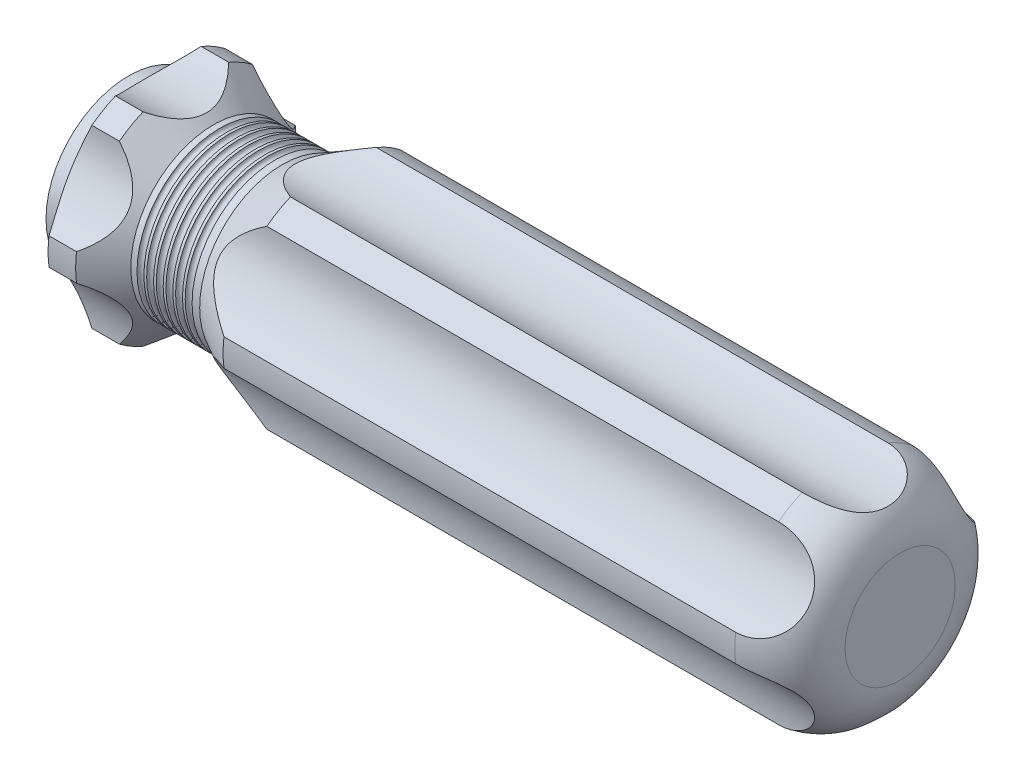
from build123d import *

# Parameters (mm, degrees)
SKETCH4_R          = 0.25
SKETCH5_R          = 6
CUT_EXTRUDE1_DEPTH = 58.131427554
CIRPATTERN1_COUNT  = 6
SKETCH6_W          = 0.189957265
SKETCH6_H          = 2.116666667
SKETCH6_H_2        = 2.170940171
CUT_EXTRUDE2_DEPTH = 1
SKETCH7_R          = 1.5
CUT_EXTRUDE3_DEPTH = 30


with BuildPart() as part:
    # Sketch1 → Revolve1 (revolve)
    with BuildSketch(Plane.XY, mode=Mode.PRIVATE) as revolve1_sk:
        with BuildLine():
            Line((0, 6), (1, 6))
            Line((1, 6), (2.154700538, 8))
            Line((2.154700538, 8), (4.154700538, 8))
            Line((4.154700538, 8), (6.154700538, 6))
            Line((6.154700538, 6), (11.154700538, 6))
            Line((11.154700538, 6), (14.855151909, 8))
            Line((14.855151909, 8), (52, 8))
            ThreePointArc((52, 8), (54.828427125, 6.828427125), (56, 4))
            Line((56, 4), (56, 0))
            Line((56, 0), (0, 0))
            Line((0, 0), (0, 6))
        make_face()
    revolve(revolve1_sk.sketch.rotate(Axis((0, 0, 0), (1, 0, 0)), 90), axis=Axis((0, 0, 0), (1, 0, 0)))

    # Sketch4 → Cut-Revolve2 (revolve, cut)
    with BuildSketch(Plane.XY, mode=Mode.PRIVATE) as cut_revolve2_sk:
        with Locations((6.854700538, 6)):
            Circle(SKETCH4_R)
        with Locations((7.554700538, 6)):
            Circle(SKETCH4_R)
        with Locations((8.254700538, 6)):
            Circle(SKETCH4_R)
        with Locations((8.954700538, 6)):
            Circle(SKETCH4_R)
        with Locations((9.654700538, 6)):
            Circle(SKETCH4_R)
        with Locations((10.354700538, 6)):
            Circle(SKETCH4_R)
    revolve(cut_revolve2_sk.sketch.rotate(Axis((0, 0, 0), (1, 0, 0)), 90), axis=Axis((0, 0, 0), (1, 0, 0)), mode=Mode.SUBTRACT)

    # Sketch5 → Cut-Extrude1 (cut, through all)
    with BuildSketch(Plane.ZY):
        with Locations((0, 12.5)):
            Circle(SKETCH5_R)
    cut_extrude1 = extrude(amount=-CUT_EXTRUDE1_DEPTH, mode=Mode.SUBTRACT)

    # CirPattern1: Cut-Extrude1 ×6 about axis
    cirpattern1_axis = Axis((0, 0, 0), (1, 0, 0))
    for i in range(1, CIRPATTERN1_COUNT):
        add(cut_extrude1.rotate(cirpattern1_axis, i * 360 / CIRPATTERN1_COUNT), mode=Mode.SUBTRACT)

    # Sketch6 → Cut-Extrude2 (cut)
    # profile 1 of 13: a face of its own
    with BuildSketch(Plane(origin=(0, 0, 0), x_dir=(1, 0, 0), z_dir=(0, 1, 0))):
        with Locations((20.973877339, 1.058333334)):
            Rectangle(SKETCH6_W, SKETCH6_H)
    # profile 2 of 13: a face of its own
    with BuildSketch(Plane(origin=(0, 0, 0), x_dir=(1, 0, 0), z_dir=(0, 1, 0))):
        with BuildLine():
            Line((21.378214946, 1.546794872), (21.568172211, 1.546794872))
            Line((21.568172211, 1.546794872), (21.568172211, 1.277971421))
            add(Edge.make_bspline(
                [(21.568172211, 1.277971421), (21.585277266, 1.301489161), (21.618052192, 1.346551406), (21.671794753, 1.405933149), (21.725483164, 1.456326843), (21.764147638, 1.482780865), (21.782722157, 1.49548945)],
                knots=[0, 0, 0, 0, 1.134379233, 2.173579362, 3.122582517, 4, 4, 4, 4], degree=3))
            add(Edge.make_bspline(
                [(21.782722157, 1.49548945), (21.80804031, 1.507587933), (21.858234278, 1.531573524), (21.937711619, 1.555905247), (22.019036776, 1.570858047), (22.073954125, 1.572902972), (22.101578995, 1.573931624)],
                knots=[0, 0, 0, 0, 1.014936303, 2.012140481, 3.000054389, 4, 4, 4, 4], degree=3))
            add(Edge.make_bspline(
                [(22.101578995, 1.573931624), (22.120261902, 1.573299472), (22.157234372, 1.572048477), (22.212016178, 1.56390836), (22.26514972, 1.549837865), (22.316321061, 1.53023915), (22.364533091, 1.506504249), (22.408734654, 1.47865514), (22.448421675, 1.447390718), (22.483574096, 1.411299173), (22.515184412, 1.36936704), (22.544260667, 1.320463423), (22.571127343, 1.263490218), (22.586017372, 1.222144739), (22.593856639, 1.20037727)],
                knots=[0, 0, 0, 0, 1.009824226, 1.998387844, 2.986035974, 3.974953746, 4.955485308, 5.885931332, 6.793869504, 7.679848016, 8.601185859, 9.625726857, 10.749998409, 12, 12, 12, 12], degree=3))
            add(Edge.make_bspline(
                [(22.593856639, 1.20037727), (22.602148682, 1.215329657), (22.618466257, 1.244753855), (22.64586538, 1.286396709), (22.674572095, 1.325347483), (22.70483105, 1.361637082), (22.736535443, 1.3950863), (22.769834481, 1.425805726), (22.80453861, 1.453927284), (22.852793917, 1.486779862), (22.915575828, 1.521675338), (22.994731973, 1.551930635), (23.07707041, 1.570627532), (23.132961114, 1.572822982), (23.161184363, 1.573931624)],
                knots=[0, 0, 0, 0, 0.86119277, 1.694706429, 2.50939023, 3.298075842, 4.073795165, 4.829715201, 5.57930267, 6.321991688, 7.768977793, 9.186738141, 10.579381044, 12, 12, 12, 12], degree=3))
            add(Edge.make_bspline(
                [(23.161184363, 1.573931624), (23.187117439, 1.57295359), (23.237870985, 1.571039484), (23.31175914, 1.55600905), (23.380666804, 1.530199235), (23.444455321, 1.49498175), (23.502004351, 1.450725767), (23.552028024, 1.398069851), (23.594222482, 1.337386456), (23.621786707, 1.280301777), (23.640483081, 1.229903742), (23.652010589, 1.186961842), (23.662194595, 1.13969876), (23.67064992, 1.088057983), (23.676829711, 1.031857091), (23.681408191, 0.971188057), (23.684507036, 0.906003727), (23.684726003, 0.861030306), (23.684838877, 0.837847222)],
                knots=[0, 0, 0, 0, 1.209669288, 2.367440248, 3.500751976, 4.631527125, 5.755587489, 6.87532382, 8.007944318, 9.190864318, 9.82315674, 10.514484317, 11.263564316, 12.079023757, 12.955305781, 13.901327259, 14.918167583, 16, 16, 16, 16], degree=3))
            Line((23.684838877, 0.837847222), (23.684838877, 0))
            Line((23.684838877, 0), (23.494881612, 0))
            Line((23.494881612, 0), (23.494881612, 0.838695246))
            add(Edge.make_bspline(
                [(23.494881612, 0.838695246), (23.494834512, 0.858483402), (23.494743991, 0.89651323), (23.493114986, 0.951094474), (23.490045629, 1.000847243), (23.486456586, 1.045703696), (23.481471044, 1.085768439), (23.47503279, 1.120960997), (23.468212479, 1.151558207), (23.456881665, 1.185476912), (23.438770321, 1.222893658), (23.411182607, 1.263245535), (23.376426876, 1.298370591), (23.336294781, 1.328861668), (23.29060596, 1.35365306), (23.240250627, 1.371358076), (23.185541415, 1.382318102), (23.147669538, 1.383410312), (23.128111447, 1.383974359)],
                knots=[0, 0, 0, 0, 1.253487763, 2.409012846, 3.458416907, 4.410876679, 5.259312806, 6.014470957, 6.676830364, 7.243083969, 8.276244668, 9.299465089, 10.325150304, 11.392391894, 12.482080715, 13.603491619, 14.762376348, 16, 16, 16, 16], degree=3))
            add(Edge.make_bspline(
                [(23.128111447, 1.383974359), (23.10412057, 1.383117921), (23.056705476, 1.381425274), (22.987493205, 1.364144884), (22.920986924, 1.338091589), (22.859171106, 1.300334818), (22.80230668, 1.255093569), (22.753381697, 1.201300242), (22.712964137, 1.140443096), (22.685596256, 1.084111519), (22.668306536, 1.033511427), (22.656890497, 0.989304921), (22.648010541, 0.939060353), (22.639682649, 0.883115347), (22.634247214, 0.821084809), (22.629307293, 0.753255681), (22.626996581, 0.679423953), (22.626673361, 0.628244956), (22.626505544, 0.601672676)],
                knots=[0, 0, 0, 0, 1.090531906, 2.155305635, 3.229839962, 4.33261226, 5.44038871, 6.529323825, 7.629011124, 8.757537029, 9.370236727, 10.061839251, 10.834451254, 11.692844982, 12.636905849, 13.66920014, 14.789842145, 16, 16, 16, 16], degree=3))
            Line((22.626505544, 0.601672676), (22.626505544, 0))
            Line((22.626505544, 0), (22.436548279, 0))
            Line((22.436548279, 0), (22.436548279, 0.7865418))
            add(Edge.make_bspline(
                [(22.436548279, 0.7865418), (22.436500242, 0.808732522), (22.436407824, 0.851425239), (22.434789289, 0.912647509), (22.431713094, 0.968334639), (22.428156763, 1.018421905), (22.423040369, 1.06281828), (22.417228751, 1.101761776), (22.410365544, 1.135154764), (22.399002137, 1.171781192), (22.381636721, 1.212131464), (22.353703819, 1.255154844), (22.318864949, 1.292812217), (22.278000658, 1.324960603), (22.232035317, 1.351534737), (22.181245355, 1.370681349), (22.126088098, 1.381823657), (22.088062057, 1.383243939), (22.068506078, 1.383974359)],
                knots=[0, 0, 0, 0, 1.320475261, 2.540461679, 3.643808994, 4.639130445, 5.527981419, 6.302341397, 6.981980563, 7.553956391, 8.582137848, 9.585246428, 10.591171744, 11.620968678, 12.668337649, 13.738356861, 14.836885341, 16, 16, 16, 16], degree=3))
            add(Edge.make_bspline(
                [(22.068506078, 1.383974359), (22.045515322, 1.383048795), (21.999695561, 1.381204179), (21.932384369, 1.36460088), (21.867381123, 1.338593654), (21.805722805, 1.302513668), (21.749072248, 1.257822321), (21.699476773, 1.205259503), (21.657782959, 1.145479373), (21.6301261, 1.089741784), (21.612286547, 1.040409375), (21.600436035, 0.998468564), (21.59025207, 0.951901747), (21.582684067, 0.900565256), (21.575378292, 0.844793452), (21.571852343, 0.784308498), (21.568422398, 0.719162283), (21.568257652, 0.674184601), (21.568172211, 0.65085804)],
                knots=[0, 0, 0, 0, 1.098833095, 2.189935336, 3.297829714, 4.440610912, 5.596351641, 6.740013378, 7.886572111, 9.072425424, 9.705826452, 10.395263256, 11.156850408, 11.985370555, 12.878090359, 13.847760091, 14.883794034, 16, 16, 16, 16], degree=3))
            Line((21.568172211, 0.65085804), (21.568172211, 0))
            Line((21.568172211, 0), (21.378214946, 0))
            Line((21.378214946, 0), (21.378214946, 1.546794872))
        make_face()
    # profile 3 of 13: a face of its own
    with BuildSketch(Plane(origin=(0, 0, 0), x_dir=(1, 0, 0), z_dir=(0, 1, 0))):
        with BuildLine():
            Line((23.885650843, 1.546794872), (24.075608108, 1.546794872))
            Line((24.075608108, 1.546794872), (24.075608108, 1.319100561))
            add(Edge.make_bspline(
                [(24.075608108, 1.319100561), (24.089631786, 1.34030099), (24.116451961, 1.380846647), (24.161030733, 1.434470462), (24.206692271, 1.478869086), (24.25365517, 1.514249785), (24.302264783, 1.540746291), (24.351454273, 1.560154936), (24.401997533, 1.571631693), (24.435962125, 1.573163953), (24.452978568, 1.573931624)],
                knots=[0, 0, 0, 0, 1.2804753, 2.448899062, 3.506932113, 4.484331642, 5.4025378, 6.288909075, 7.142734305, 8, 8, 8, 8], degree=3))
            add(Edge.make_bspline(
                [(24.452978568, 1.573931624), (24.466178298, 1.573211639), (24.493337602, 1.571730223), (24.534450883, 1.561321772), (24.576810494, 1.54470411), (24.60411089, 1.529076928), (24.618343151, 1.520930155)],
                knots=[0, 0, 0, 0, 0.901110191, 1.854092781, 2.881294221, 4, 4, 4, 4], degree=3))
            Line((24.618343151, 1.520930155), (24.51403626, 1.356413595))
            add(Edge.make_bspline(
                [(24.51403626, 1.356413595), (24.504898899, 1.360489851), (24.48755444, 1.368227366), (24.462181917, 1.377384677), (24.438788918, 1.382776683), (24.423885433, 1.383593545), (24.416937569, 1.383974359)],
                knots=[0, 0, 0, 0, 1.180555205, 2.24091978, 3.179933427, 4, 4, 4, 4], degree=3))
            add(Edge.make_bspline(
                [(24.416937569, 1.383974359), (24.401694101, 1.382958336), (24.370601846, 1.380885945), (24.324951697, 1.36459438), (24.280654577, 1.338271973), (24.245474572, 1.309079443), (24.218234733, 1.280929109), (24.198797549, 1.256346503), (24.180967507, 1.228782283), (24.163931231, 1.198707665), (24.148409234, 1.165609139), (24.133922362, 1.129817386), (24.120823907, 1.091290951), (24.11335495, 1.064450094), (24.109529048, 1.050701122)],
                knots=[0, 0, 0, 0, 1.125678352, 2.296057538, 3.5422874, 4.923748041, 5.663163013, 6.437101912, 7.23742474, 8.08941207, 8.991984279, 9.93940061, 10.944477711, 12, 12, 12, 12], degree=3))
            add(Edge.make_bspline(
                [(24.109529048, 1.050701122), (24.106667077, 1.03843826), (24.100328028, 1.011276952), (24.094164574, 0.965709035), (24.088074914, 0.911870917), (24.083783149, 0.84961274), (24.079805, 0.779089976), (24.077561283, 0.70019519), (24.075684622, 0.612847401), (24.075634387, 0.551781959), (24.075608108, 0.519838408)],
                knots=[0, 0, 0, 0, 0.566838948, 1.255505196, 2.06880316, 3.007127437, 4.065329342, 5.249902469, 6.561414163, 8, 8, 8, 8], degree=3))
            Line((24.075608108, 0.519838408), (24.075608108, 0))
            Line((24.075608108, 0), (23.885650843, 0))
            Line((23.885650843, 0), (23.885650843, 1.546794872))
        make_face()
    # profile 4 of 13: a face of its own
    with BuildSketch(Plane(origin=(0, 0, 0), x_dir=(1, 0, 0), z_dir=(0, 1, 0))):
        with BuildLine():
            Line((26.203129476, 1.546794872), (26.203129476, 0))
            Line((26.203129476, 0), (26.013172211, 0))
            Line((26.013172211, 0), (26.013172211, 0.267551416))
            add(Edge.make_bspline(
                [(26.013172211, 0.267551416), (25.991752275, 0.243336994), (25.949951002, 0.196082247), (25.880136612, 0.134346838), (25.806133, 0.083318044), (25.728299343, 0.042103571), (25.64670593, 0.011144565), (25.561533629, -0.010860398), (25.472747699, -0.025008098), (25.412118894, -0.026420835), (25.3813947, -0.027136752)],
                knots=[0, 0, 0, 0, 1.074387032, 2.096679803, 3.090159297, 4.057316773, 5.018401886, 5.985159533, 6.978961417, 8, 8, 8, 8], degree=3))
            add(Edge.make_bspline(
                [(25.3813947, -0.027136752), (25.354078842, -0.026395089), (25.300210761, -0.024932496), (25.220969367, -0.01358577), (25.144713578, 0.004636082), (25.071371336, 0.029976144), (25.001417229, 0.063589308), (24.934252314, 0.10383092), (24.870224543, 0.151752755), (24.81030985, 0.206536944), (24.755136212, 0.266042483), (24.706718204, 0.329509552), (24.666348484, 0.396663707), (24.632590626, 0.46665471), (24.606588075, 0.540021352), (24.588461163, 0.616509925), (24.577127655, 0.696029991), (24.575665666, 0.750180084), (24.574924347, 0.777637553)],
                knots=[0, 0, 0, 0, 1.033919861, 2.038935746, 3.024066025, 3.998881131, 4.97069526, 5.957263378, 6.95902576, 7.993208707, 9.027059324, 10.027763471, 11.009749337, 11.988697705, 12.965288445, 13.950418724, 14.960734635, 16, 16, 16, 16], degree=3))
            add(Edge.make_bspline(
                [(24.574924347, 0.777637553), (24.575682097, 0.804527507), (24.577180126, 0.857687496), (24.588339931, 0.935870328), (24.607106303, 1.011174228), (24.633442382, 1.083356761), (24.667213469, 1.152505267), (24.708293788, 1.218668654), (24.756686307, 1.282029194), (24.812477048, 1.341097031), (24.87291379, 1.395659022), (24.937568118, 1.443077825), (25.004831721, 1.484030396), (25.075747923, 1.516477974), (25.149267077, 1.542730147), (25.226043684, 1.560892942), (25.305758306, 1.571595608), (25.359878746, 1.57314547), (25.387330865, 1.573931624)],
                knots=[0, 0, 0, 0, 1.020392517, 2.01726096, 2.990465484, 3.961182959, 4.928053699, 5.906110375, 6.912531644, 7.948652711, 8.985773172, 9.998621852, 10.987621588, 11.969261332, 12.953316658, 13.946091881, 14.958173133, 16, 16, 16, 16], degree=3))
            add(Edge.make_bspline(
                [(25.387330865, 1.573931624), (25.418899351, 1.573062127), (25.480803662, 1.571357083), (25.571353458, 1.55716772), (25.657014643, 1.533195885), (25.738448465, 1.500588636), (25.815362499, 1.457258214), (25.887028589, 1.402599857), (25.954196763, 1.336958282), (25.993131511, 1.286539013), (26.013172211, 1.260586939)],
                knots=[0, 0, 0, 0, 1.038897134, 2.037228247, 3.008116434, 3.962042015, 4.918381754, 5.904844433, 6.921570401, 8, 8, 8, 8], degree=3))
            Line((26.013172211, 1.260586939), (26.013172211, 1.546794872))
            Line((26.013172211, 1.546794872), (26.203129476, 1.546794872))
        make_face()
        with BuildLine():
            add(Edge.make_bspline(
                [(25.389874935, 1.383974359), (25.362107693, 1.382986397), (25.307299573, 1.381036318), (25.226839629, 1.365812347), (25.149845326, 1.34048214), (25.076701747, 1.305840228), (25.008564302, 1.262279992), (24.947668606, 1.209592298), (24.893516591, 1.149214675), (24.847973022, 1.08141959), (24.810846388, 1.008740458), (24.784740612, 0.932767584), (24.767523495, 0.85487124), (24.765764533, 0.802037616), (24.764881612, 0.775517495)],
                knots=[0, 0, 0, 0, 1.031046209, 2.035121221, 3.029706178, 4.034933723, 5.034054252, 6.02443088, 7.017295772, 8.038157696, 9.050218397, 10.03989886, 11.016116709, 12, 12, 12, 12], degree=3))
            add(Edge.make_bspline(
                [(24.764881612, 0.775517495), (24.766009429, 0.749155858), (24.768260641, 0.696535915), (24.784438442, 0.618533375), (24.81158008, 0.542542598), (24.848616946, 0.469208568), (24.894994095, 0.401121993), (24.948750566, 0.339593443), (25.010406213, 0.286683073), (25.078700467, 0.242391778), (25.151639573, 0.206612539), (25.228343903, 0.181717129), (25.307371551, 0.1656439), (25.361106057, 0.16376643), (25.388178888, 0.162820513)],
                knots=[0, 0, 0, 0, 0.979072187, 1.954306742, 2.945804271, 3.96968567, 4.997920485, 5.998718438, 6.996577872, 8.005894225, 9.015743152, 10.005417472, 10.995077863, 12, 12, 12, 12], degree=3))
            add(Edge.make_bspline(
                [(25.388178888, 0.162820513), (25.415663202, 0.163824396), (25.470326775, 0.165821019), (25.551025422, 0.181110166), (25.629339043, 0.206370344), (25.704200843, 0.24138553), (25.773939646, 0.284781645), (25.83653122, 0.335585933), (25.889457543, 0.394673097), (25.934326407, 0.459610285), (25.969508683, 0.530798017), (25.995136109, 0.60659536), (26.010287757, 0.687004956), (26.012197432, 0.741955997), (26.013172211, 0.770005342)],
                knots=[0, 0, 0, 0, 1.01762866, 2.023962475, 3.030623092, 4.058876274, 5.077231937, 6.066672613, 7.034107872, 8.005628644, 8.981990164, 9.965428785, 10.961468474, 12, 12, 12, 12], degree=3))
            add(Edge.make_bspline(
                [(26.013172211, 0.770005342), (26.012591847, 0.791376316), (26.011449508, 0.833441155), (26.002722449, 0.895203987), (25.988840184, 0.954309621), (25.969278453, 1.0108202), (25.943581343, 1.064423281), (25.912588646, 1.115503745), (25.87575535, 1.163795925), (25.833674386, 1.20863483), (25.787612573, 1.249532738), (25.738872066, 1.286038731), (25.686875395, 1.316028132), (25.632496996, 1.34084833), (25.575642523, 1.360599339), (25.515849338, 1.373775706), (25.453752998, 1.382823139), (25.411391813, 1.383586579), (25.389874935, 1.383974359)],
                knots=[0, 0, 0, 0, 1.050140795, 2.067009409, 3.05949893, 4.030605086, 5.00011959, 5.97591094, 6.962425594, 7.979863591, 8.993523472, 9.986985069, 10.967611495, 11.937549037, 12.921786183, 13.919465291, 14.943216303, 16, 16, 16, 16], degree=3))
        make_face(mode=Mode.SUBTRACT)
    # profile 5 of 13: a face of its own
    with BuildSketch(Plane(origin=(0, 0, 0), x_dir=(1, 0, 0), z_dir=(0, 1, 0))):
        with BuildLine():
            Line((26.458214946, 1.546794872), (26.648172211, 1.546794872))
            Line((26.648172211, 1.546794872), (26.648172211, 1.267795139))
            add(Edge.make_bspline(
                [(26.648172211, 1.267795139), (26.668454495, 1.293100024), (26.707812975, 1.342205035), (26.773359691, 1.406745573), (26.842631478, 1.459931495), (26.915204118, 1.502327599), (26.991176129, 1.534287225), (27.070084416, 1.557368527), (27.152401405, 1.571208399), (27.20838085, 1.573016776), (27.236700523, 1.573931624)],
                knots=[0, 0, 0, 0, 1.12780773, 2.188550248, 3.19190651, 4.159438251, 5.104880172, 6.052711206, 7.014878035, 8, 8, 8, 8], degree=3))
            add(Edge.make_bspline(
                [(27.236700523, 1.573931624), (27.265324287, 1.572876196), (27.321347899, 1.57081047), (27.402917012, 1.554471804), (27.479100921, 1.526564912), (27.549627986, 1.48833666), (27.61320492, 1.440798459), (27.669039473, 1.385415705), (27.715221056, 1.321712455), (27.746183271, 1.262613213), (27.766579258, 1.210187132), (27.779419766, 1.165285526), (27.790324217, 1.11526074), (27.799777703, 1.060263941), (27.806174337, 0.999909797), (27.811219437, 0.934445717), (27.814835124, 0.863892904), (27.814978578, 0.815096706), (27.815052553, 0.789933894)],
                knots=[0, 0, 0, 0, 1.235846778, 2.418850247, 3.575807741, 4.728682307, 5.871620074, 6.994088408, 8.11269785, 9.256955736, 9.865816715, 10.540099792, 11.271859618, 12.076849838, 12.949306005, 13.892391288, 14.913166135, 16, 16, 16, 16], degree=3))
            Line((27.815052553, 0.789933894), (27.815052553, 0))
            Line((27.815052553, 0), (27.625095288, 0))
            Line((27.625095288, 0), (27.625095288, 0.727604167))
            add(Edge.make_bspline(
                [(27.625095288, 0.727604167), (27.624978443, 0.748663455), (27.624754938, 0.788946289), (27.62405, 0.846621841), (27.622350736, 0.898925629), (27.619962946, 0.945732608), (27.616468009, 0.986997833), (27.612825751, 1.022805348), (27.608371694, 1.053109691), (27.604402694, 1.071352383), (27.602622665, 1.079533921)],
                knots=[0, 0, 0, 0, 1.430800155, 2.736877192, 3.918605307, 4.986035426, 5.920637409, 6.731861385, 7.431261377, 8, 8, 8, 8], degree=3))
            add(Edge.make_bspline(
                [(27.602622665, 1.079533921), (27.596196748, 1.103549733), (27.583828847, 1.14977274), (27.553267819, 1.212471039), (27.514675433, 1.265809943), (27.467565781, 1.309459675), (27.412393912, 1.343429657), (27.349312926, 1.36699962), (27.278931557, 1.381741459), (27.229429145, 1.383209296), (27.203627606, 1.383974359)],
                knots=[0, 0, 0, 0, 1.084156227, 2.086665306, 3.027808233, 3.945421172, 4.874247719, 5.839848303, 6.874090471, 8, 8, 8, 8], degree=3))
            add(Edge.make_bspline(
                [(27.203627606, 1.383974359), (27.188346674, 1.383686489), (27.158106103, 1.383116803), (27.113263025, 1.377401018), (27.069766025, 1.368052333), (27.027178565, 1.355431776), (26.986352423, 1.338097928), (26.945975923, 1.318425404), (26.907569452, 1.29390339), (26.870314064, 1.266573824), (26.835653461, 1.236287827), (26.803402514, 1.20432948), (26.77465333, 1.170296139), (26.748607036, 1.134736171), (26.726123038, 1.097161202), (26.706496647, 1.05793374), (26.689844108, 1.017002155), (26.681569337, 0.988593428), (26.677429022, 0.974379006)],
                knots=[0, 0, 0, 0, 1.023777757, 2.026029729, 3.023749952, 4.003683103, 4.997618607, 5.993177895, 7.010360494, 8.046726602, 9.087585522, 10.09234134, 11.086953743, 12.070360549, 13.043493632, 14.017870808, 15.008233677, 16, 16, 16, 16], degree=3))
            add(Edge.make_bspline(
                [(26.677429022, 0.974379006), (26.675046472, 0.963943717), (26.669859787, 0.941226638), (26.664257769, 0.903946441), (26.659173187, 0.860820885), (26.654917503, 0.811900293), (26.652313751, 0.757013388), (26.649474759, 0.696394572), (26.648441184, 0.629802129), (26.648264379, 0.583440057), (26.648172211, 0.559271501)],
                knots=[0, 0, 0, 0, 0.615963638, 1.340920617, 2.168419149, 3.115676021, 4.16674242, 5.331190069, 6.6087489, 8, 8, 8, 8], degree=3))
            Line((26.648172211, 0.559271501), (26.648172211, 0))
            Line((26.648172211, 0), (26.458214946, 0))
            Line((26.458214946, 0), (26.458214946, 1.546794872))
        make_face()
    # profile 6 of 13: a face of its own
    with BuildSketch(Plane(origin=(0, 0, 0), x_dir=(1, 0, 0), z_dir=(0, 1, 0))):
        Polygon((28.176140961, 1.51965812), (28.044273306, 1.51965812), (28.015864518, 2.170940171), (28.205821783, 2.170940171), align=None)
    # profile 7 of 13: a face of its own
    with BuildSketch(Plane(origin=(0, 0, 0), x_dir=(1, 0, 0), z_dir=(0, 1, 0))):
        with BuildLine():
            Line((29.193599561, 1.353869525), (29.064699988, 1.221153846))
            add(Edge.make_bspline(
                [(29.064699988, 1.221153846), (29.053578113, 1.234043225), (29.032136445, 1.25889243), (28.998129787, 1.292116275), (28.964248846, 1.320018138), (28.930957421, 1.343574981), (28.897418372, 1.361384703), (28.864025284, 1.374383976), (28.83074358, 1.382428402), (28.808496787, 1.383465229), (28.797572585, 1.383974359)],
                knots=[0, 0, 0, 0, 1.26578478, 2.440284043, 3.530471711, 4.527705817, 5.468200915, 6.346673037, 7.188140097, 8, 8, 8, 8], degree=3))
            add(Edge.make_bspline(
                [(28.797572585, 1.383974359), (28.784183525, 1.383324317), (28.757835751, 1.382045126), (28.720082994, 1.369276527), (28.685036664, 1.349676957), (28.654703633, 1.321876909), (28.629008702, 1.289967089), (28.61025281, 1.254288359), (28.598782905, 1.215917399), (28.597328615, 1.189289819), (28.596591014, 1.175784589)],
                knots=[0, 0, 0, 0, 0.99966794, 1.967205029, 2.953328237, 3.988086729, 5.028030931, 6.008226631, 6.989793394, 8, 8, 8, 8], degree=3))
            add(Edge.make_bspline(
                [(28.596591014, 1.175784589), (28.597262791, 1.163561114), (28.598604451, 1.139148624), (28.609034586, 1.103136241), (28.62564502, 1.068025556), (28.641169375, 1.046518465), (28.649168471, 1.035436699)],
                knots=[0, 0, 0, 0, 0.960159726, 1.917612774, 2.927026955, 4, 4, 4, 4], degree=3))
            add(Edge.make_bspline(
                [(28.649168471, 1.035436699), (28.653984489, 1.029519355), (28.664234776, 1.016925034), (28.683471354, 0.999445085), (28.705256391, 0.980127628), (28.731454639, 0.960813446), (28.760937404, 0.94047426), (28.794344018, 0.919911065), (28.830614314, 0.897556389), (28.856581162, 0.883378087), (28.870078594, 0.87600828)],
                knots=[0, 0, 0, 0, 0.66740084, 1.420478572, 2.27185888, 3.217733974, 4.268547843, 5.408967954, 6.65319498, 8, 8, 8, 8], degree=3))
            add(Edge.make_bspline(
                [(28.870078594, 0.87600828), (28.886536329, 0.866788743), (28.918327253, 0.848979635), (28.963498593, 0.821336147), (29.004493613, 0.793860953), (29.04165966, 0.766847887), (29.074281611, 0.739541153), (29.103349222, 0.712987414), (29.128137471, 0.686384356), (29.142019131, 0.66779814), (29.148654315, 0.658914263)],
                knots=[0, 0, 0, 0, 1.27191281, 2.456916733, 3.569705269, 4.599008579, 5.553216877, 6.436649441, 7.252746552, 8, 8, 8, 8], degree=3))
            add(Edge.make_bspline(
                [(29.148654315, 0.658914263), (29.159667349, 0.640973343), (29.181585329, 0.605267583), (29.204601518, 0.546473581), (29.217942732, 0.484116277), (29.219794646, 0.441461078), (29.220736313, 0.419771635)],
                knots=[0, 0, 0, 0, 0.995354457, 1.980940102, 2.973342416, 4, 4, 4, 4], degree=3))
            add(Edge.make_bspline(
                [(29.220736313, 0.419771635), (29.220301167, 0.404489818), (29.219443663, 0.374375328), (29.213481879, 0.330025216), (29.203228155, 0.287610508), (29.189261933, 0.246670979), (29.170402812, 0.207991048), (29.148300097, 0.170594841), (29.121766221, 0.135291302), (29.091472866, 0.102126788), (29.0583044, 0.071836836), (29.022922117, 0.045212825), (28.985282443, 0.02309406), (28.94565433, 0.004790732), (28.903947739, -0.009764834), (28.86015615, -0.019841698), (28.81441876, -0.025872844), (28.783315971, -0.026710122), (28.76746775, -0.027136752)],
                knots=[0, 0, 0, 0, 1.032770009, 2.035186124, 3.017557409, 3.978232242, 4.952395191, 5.920591857, 6.910227898, 7.931268572, 8.952309245, 9.941945286, 10.918353717, 11.897095711, 12.887975737, 13.898235213, 14.929059601, 16, 16, 16, 16], degree=3))
            add(Edge.make_bspline(
                [(28.76746775, -0.027136752), (28.74607903, -0.026536405), (28.703598784, -0.025344052), (28.640770239, -0.014152291), (28.579374352, 0.003262066), (28.519875734, 0.02728075), (28.463604989, 0.057609991), (28.412121049, 0.093933438), (28.36524507, 0.135051199), (28.338564018, 0.166567102), (28.325223493, 0.182325053)],
                knots=[0, 0, 0, 0, 1.013940152, 2.01379169, 3.017749504, 4.037548394, 5.051665909, 6.043208538, 7.021604269, 8, 8, 8, 8], degree=3))
            Line((28.325223493, 0.182325053), (28.451154983, 0.325641026))
            add(Edge.make_bspline(
                [(28.451154983, 0.325641026), (28.463112585, 0.312726478), (28.486294205, 0.287689673), (28.523366846, 0.254352572), (28.561091531, 0.226411803), (28.599091556, 0.203041738), (28.637929422, 0.185034709), (28.677387484, 0.17238394), (28.717385484, 0.164253405), (28.744250299, 0.16329892), (28.75771548, 0.162820513)],
                knots=[0, 0, 0, 0, 1.179806542, 2.287233372, 3.337373186, 4.324005949, 5.273901747, 6.200048787, 7.097828587, 8, 8, 8, 8], degree=3))
            add(Edge.make_bspline(
                [(28.75771548, 0.162820513), (28.776050607, 0.163649535), (28.811874368, 0.165269307), (28.863184641, 0.179975358), (28.910560858, 0.2030349), (28.951698786, 0.235743265), (28.986715808, 0.273816397), (29.01207237, 0.316702555), (29.0279632, 0.363143102), (29.029829495, 0.395335971), (29.030779048, 0.411715411)],
                knots=[0, 0, 0, 0, 1.072336372, 2.095165389, 3.102688358, 4.141489647, 5.156069229, 6.117746104, 7.042326257, 8, 8, 8, 8], degree=3))
            add(Edge.make_bspline(
                [(29.030779048, 0.411715411), (29.030122099, 0.425207419), (29.02882504, 0.451845582), (29.018638871, 0.490399359), (29.002544432, 0.526968877), (28.986696859, 0.548371187), (28.978625603, 0.559271501)],
                knots=[0, 0, 0, 0, 1.013901739, 2.00181326, 2.98231254, 4, 4, 4, 4], degree=3))
            add(Edge.make_bspline(
                [(28.978625603, 0.559271501), (28.973773964, 0.564735744), (28.963205343, 0.576638838), (28.943819555, 0.593829243), (28.920607666, 0.612357998), (28.893308615, 0.631910912), (28.861867369, 0.652230068), (28.826156496, 0.673208867), (28.78666521, 0.69584373), (28.758742971, 0.710853712), (28.744147104, 0.71869992)],
                knots=[0, 0, 0, 0, 0.615000592, 1.339693406, 2.178160186, 3.116406724, 4.166410947, 5.330106347, 6.604359322, 8, 8, 8, 8], degree=3))
            add(Edge.make_bspline(
                [(28.744147104, 0.71869992), (28.728395088, 0.727492633), (28.697846903, 0.744544509), (28.654577827, 0.771103282), (28.615542046, 0.798116348), (28.57980027, 0.824068398), (28.548255281, 0.850327731), (28.52103135, 0.876923497), (28.497056643, 0.902783108), (28.483783685, 0.921105759), (28.477443712, 0.929857772)],
                knots=[0, 0, 0, 0, 1.262093308, 2.447601706, 3.550203992, 4.582594899, 5.537233252, 6.418365656, 7.244515135, 8, 8, 8, 8], degree=3))
            add(Edge.make_bspline(
                [(28.477443712, 0.929857772), (28.466479016, 0.94748393), (28.444545792, 0.982742405), (28.423248986, 1.041592074), (28.408610102, 1.103546942), (28.407302371, 1.146295659), (28.406633749, 1.168152377)],
                knots=[0, 0, 0, 0, 0.985009483, 1.970363186, 2.962279964, 4, 4, 4, 4], degree=3))
            add(Edge.make_bspline(
                [(28.406633749, 1.168152377), (28.40695681, 1.182440118), (28.407589086, 1.210403251), (28.412635251, 1.251490061), (28.421822619, 1.290526325), (28.43334631, 1.328098285), (28.449362222, 1.363478123), (28.46850046, 1.397137641), (28.490989998, 1.429030316), (28.516899988, 1.458665543), (28.545388293, 1.485583088), (28.576167511, 1.50904702), (28.608545409, 1.529068482), (28.642659072, 1.545859794), (28.678836215, 1.55856063), (28.716823963, 1.567303906), (28.756545424, 1.573143005), (28.783699914, 1.573664965), (28.797572585, 1.573931624)],
                knots=[0, 0, 0, 0, 1.087655834, 2.128696564, 3.144119009, 4.137814668, 5.115653402, 6.093965665, 7.082169637, 8.081268856, 9.086088321, 10.061021666, 11.022561449, 11.980240094, 12.950172527, 13.934149372, 14.944599409, 16, 16, 16, 16], degree=3))
            add(Edge.make_bspline(
                [(28.797572585, 1.573931624), (28.814017309, 1.573263761), (28.847215243, 1.571915506), (28.897020183, 1.561207779), (28.946751776, 1.543589187), (28.996537802, 1.519255846), (29.046013548, 1.487767783), (29.095614219, 1.44971054), (29.145935266, 1.405334494), (29.177356465, 1.371407819), (29.193599561, 1.353869525)],
                knots=[0, 0, 0, 0, 0.845714091, 1.707292901, 2.609013841, 3.555613372, 4.552488639, 5.621697636, 6.770543573, 8, 8, 8, 8], degree=3))
        make_face()
    # profile 8 of 13: a face of its own
    with BuildSketch(Plane(origin=(0, 0, 0), x_dir=(1, 0, 0), z_dir=(0, 1, 0))):
        Polygon((30.110821783, 2.116666667), (30.300779048, 2.116666667), (30.300779048, 1.248290598), (31.386249134, 1.248290598), (31.386249134, 2.116666667), (31.576206399, 2.116666667), (31.576206399, 0), (31.386249134, 0), (31.386249134, 1.031196581), (30.300779048, 1.031196581), (30.300779048, 0), (30.110821783, 0), align=None)
    # profile 9 of 13: a face of its own
    with BuildSketch(Plane(origin=(0, 0, 0), x_dir=(1, 0, 0), z_dir=(0, 1, 0))):
        with BuildLine():
            Line((33.459496997, 1.546794872), (33.459496997, 0))
            Line((33.459496997, 0), (33.269539732, 0))
            Line((33.269539732, 0), (33.269539732, 0.267551416))
            add(Edge.make_bspline(
                [(33.269539732, 0.267551416), (33.248119797, 0.243336994), (33.206318524, 0.196082247), (33.136504133, 0.134346838), (33.062500521, 0.083318044), (32.984666865, 0.042103571), (32.903073451, 0.011144565), (32.817901151, -0.010860398), (32.72911522, -0.025008098), (32.668486415, -0.026420835), (32.637762221, -0.027136752)],
                knots=[0, 0, 0, 0, 1.074387032, 2.096679803, 3.090159297, 4.057316773, 5.018401886, 5.985159533, 6.978961417, 8, 8, 8, 8], degree=3))
            add(Edge.make_bspline(
                [(32.637762221, -0.027136752), (32.610446364, -0.026395089), (32.556578283, -0.024932496), (32.477336888, -0.01358577), (32.401081099, 0.004636082), (32.327738858, 0.029976144), (32.257784751, 0.063589308), (32.190619835, 0.10383092), (32.126592064, 0.151752755), (32.066677372, 0.206536944), (32.011503733, 0.266042483), (31.963085726, 0.329509552), (31.922716006, 0.396663707), (31.888958148, 0.46665471), (31.862955596, 0.540021352), (31.844828684, 0.616509925), (31.833495176, 0.696029991), (31.832033188, 0.750180084), (31.831291869, 0.777637553)],
                knots=[0, 0, 0, 0, 1.033919861, 2.038935746, 3.024066025, 3.998881131, 4.97069526, 5.957263378, 6.95902576, 7.993208707, 9.027059324, 10.027763471, 11.009749337, 11.988697705, 12.965288445, 13.950418724, 14.960734635, 16, 16, 16, 16], degree=3))
            add(Edge.make_bspline(
                [(31.831291869, 0.777637553), (31.832049618, 0.804527507), (31.833547648, 0.857687496), (31.844707452, 0.935870328), (31.863473824, 1.011174228), (31.889809903, 1.083356761), (31.92358099, 1.152505267), (31.96466131, 1.218668654), (32.013053828, 1.282029194), (32.068844569, 1.341097031), (32.129281311, 1.395659022), (32.193935639, 1.443077825), (32.261199243, 1.484030396), (32.332115444, 1.516477974), (32.405634598, 1.542730147), (32.482411206, 1.560892942), (32.562125827, 1.571595608), (32.616246267, 1.57314547), (32.643698386, 1.573931624)],
                knots=[0, 0, 0, 0, 1.020392517, 2.01726096, 2.990465484, 3.961182959, 4.928053699, 5.906110375, 6.912531644, 7.948652711, 8.985773172, 9.998621852, 10.987621588, 11.969261332, 12.953316658, 13.946091881, 14.958173133, 16, 16, 16, 16], degree=3))
            add(Edge.make_bspline(
                [(32.643698386, 1.573931624), (32.675266872, 1.573062127), (32.737171184, 1.571357083), (32.82772098, 1.55716772), (32.913382164, 1.533195885), (32.994815986, 1.500588636), (33.07173002, 1.457258214), (33.143396111, 1.402599857), (33.210564284, 1.336958282), (33.249499032, 1.286539013), (33.269539732, 1.260586939)],
                knots=[0, 0, 0, 0, 1.038897134, 2.037228247, 3.008116434, 3.962042015, 4.918381754, 5.904844433, 6.921570401, 8, 8, 8, 8], degree=3))
            Line((33.269539732, 1.260586939), (33.269539732, 1.546794872))
            Line((33.269539732, 1.546794872), (33.459496997, 1.546794872))
        make_face()
        with BuildLine():
            add(Edge.make_bspline(
                [(32.646242456, 1.383974359), (32.618475214, 1.382986397), (32.563667094, 1.381036318), (32.48320715, 1.365812347), (32.406212847, 1.34048214), (32.333069269, 1.305840228), (32.264931824, 1.262279992), (32.204036127, 1.209592298), (32.149884113, 1.149214675), (32.104340543, 1.08141959), (32.06721391, 1.008740458), (32.041108133, 0.932767584), (32.023891017, 0.85487124), (32.022132054, 0.802037616), (32.021249134, 0.775517495)],
                knots=[0, 0, 0, 0, 1.031046209, 2.035121221, 3.029706178, 4.034933723, 5.034054252, 6.02443088, 7.017295772, 8.038157696, 9.050218397, 10.03989886, 11.016116709, 12, 12, 12, 12], degree=3))
            add(Edge.make_bspline(
                [(32.021249134, 0.775517495), (32.02237695, 0.749155858), (32.024628162, 0.696535915), (32.040805963, 0.618533375), (32.067947601, 0.542542598), (32.104984468, 0.469208568), (32.151361617, 0.401121993), (32.205118088, 0.339593443), (32.266773734, 0.286683073), (32.335067988, 0.242391778), (32.408007094, 0.206612539), (32.484711424, 0.181717129), (32.563739072, 0.1656439), (32.617473579, 0.16376643), (32.644546409, 0.162820513)],
                knots=[0, 0, 0, 0, 0.979072187, 1.954306742, 2.945804271, 3.96968567, 4.997920485, 5.998718438, 6.996577872, 8.005894225, 9.015743152, 10.005417472, 10.995077863, 12, 12, 12, 12], degree=3))
            add(Edge.make_bspline(
                [(32.644546409, 0.162820513), (32.672030723, 0.163824396), (32.726694297, 0.165821019), (32.807392944, 0.181110166), (32.885706564, 0.206370344), (32.960568364, 0.24138553), (33.030307167, 0.284781645), (33.092898741, 0.335585933), (33.145825065, 0.394673097), (33.190693929, 0.459610285), (33.225876204, 0.530798017), (33.251503631, 0.60659536), (33.266655278, 0.687004956), (33.268564953, 0.741955997), (33.269539732, 0.770005342)],
                knots=[0, 0, 0, 0, 1.01762866, 2.023962475, 3.030623092, 4.058876274, 5.077231937, 6.066672613, 7.034107872, 8.005628644, 8.981990164, 9.965428785, 10.961468474, 12, 12, 12, 12], degree=3))
            add(Edge.make_bspline(
                [(33.269539732, 0.770005342), (33.268959368, 0.791376316), (33.267817029, 0.833441155), (33.25908997, 0.895203987), (33.245207705, 0.954309621), (33.225645974, 1.0108202), (33.199948864, 1.064423281), (33.168956167, 1.115503745), (33.132122872, 1.163795925), (33.090041908, 1.20863483), (33.043980095, 1.249532738), (32.995239587, 1.286038731), (32.943242916, 1.316028132), (32.888864518, 1.34084833), (32.832010044, 1.360599339), (32.77221686, 1.373775706), (32.71012052, 1.382823139), (32.667759334, 1.383586579), (32.646242456, 1.383974359)],
                knots=[0, 0, 0, 0, 1.050140795, 2.067009409, 3.05949893, 4.030605086, 5.00011959, 5.97591094, 6.962425594, 7.979863591, 8.993523472, 9.986985069, 10.967611495, 11.937549037, 12.921786183, 13.919465291, 14.943216303, 16, 16, 16, 16], degree=3))
        make_face(mode=Mode.SUBTRACT)
    # profile 10 of 13: a face of its own
    with BuildSketch(Plane(origin=(0, 0, 0), x_dir=(1, 0, 0), z_dir=(0, 1, 0))):
        with BuildLine():
            Line((33.714582467, 1.546794872), (33.904539732, 1.546794872))
            Line((33.904539732, 1.546794872), (33.904539732, 1.267795139))
            add(Edge.make_bspline(
                [(33.904539732, 1.267795139), (33.924822016, 1.293100024), (33.964180496, 1.342205035), (34.029727212, 1.406745573), (34.098998999, 1.459931495), (34.171571639, 1.502327599), (34.24754365, 1.534287225), (34.326451937, 1.557368527), (34.408768926, 1.571208399), (34.464748371, 1.573016776), (34.493068044, 1.573931624)],
                knots=[0, 0, 0, 0, 1.12780773, 2.188550248, 3.19190651, 4.159438251, 5.104880172, 6.052711206, 7.014878035, 8, 8, 8, 8], degree=3))
            add(Edge.make_bspline(
                [(34.493068044, 1.573931624), (34.521691808, 1.572876196), (34.57771542, 1.57081047), (34.659284533, 1.554471804), (34.735468443, 1.526564912), (34.805995507, 1.48833666), (34.869572441, 1.440798459), (34.925406994, 1.385415705), (34.971588577, 1.321712455), (35.002550792, 1.262613213), (35.022946779, 1.210187132), (35.035787288, 1.165285526), (35.046691738, 1.11526074), (35.056145224, 1.060263941), (35.062541858, 0.999909797), (35.067586959, 0.934445717), (35.071202645, 0.863892904), (35.071346099, 0.815096706), (35.071420074, 0.789933894)],
                knots=[0, 0, 0, 0, 1.235846778, 2.418850247, 3.575807741, 4.728682307, 5.871620074, 6.994088408, 8.11269785, 9.256955736, 9.865816715, 10.540099792, 11.271859618, 12.076849838, 12.949306005, 13.892391288, 14.913166135, 16, 16, 16, 16], degree=3))
            Line((35.071420074, 0.789933894), (35.071420074, 0))
            Line((35.071420074, 0), (34.881462809, 0))
            Line((34.881462809, 0), (34.881462809, 0.727604167))
            add(Edge.make_bspline(
                [(34.881462809, 0.727604167), (34.881345964, 0.748663455), (34.88112246, 0.788946289), (34.880417521, 0.846621841), (34.878718257, 0.898925629), (34.876330468, 0.945732608), (34.87283553, 0.986997833), (34.869193272, 1.022805348), (34.864739215, 1.053109691), (34.860770215, 1.071352383), (34.858990186, 1.079533921)],
                knots=[0, 0, 0, 0, 1.430800155, 2.736877192, 3.918605307, 4.986035426, 5.920637409, 6.731861385, 7.431261377, 8, 8, 8, 8], degree=3))
            add(Edge.make_bspline(
                [(34.858990186, 1.079533921), (34.852564269, 1.103549733), (34.840196368, 1.14977274), (34.80963534, 1.212471039), (34.771042955, 1.265809943), (34.723933303, 1.309459675), (34.668761433, 1.343429657), (34.605680447, 1.36699962), (34.535299078, 1.381741459), (34.485796666, 1.383209296), (34.459995127, 1.383974359)],
                knots=[0, 0, 0, 0, 1.084156227, 2.086665306, 3.027808233, 3.945421172, 4.874247719, 5.839848303, 6.874090471, 8, 8, 8, 8], degree=3))
            add(Edge.make_bspline(
                [(34.459995127, 1.383974359), (34.444714195, 1.383686489), (34.414473624, 1.383116803), (34.369630546, 1.377401018), (34.326133546, 1.368052333), (34.283546086, 1.355431776), (34.242719944, 1.338097928), (34.202343445, 1.318425404), (34.163936973, 1.29390339), (34.126681585, 1.266573824), (34.092020982, 1.236287827), (34.059770035, 1.20432948), (34.031020851, 1.170296139), (34.004974557, 1.134736171), (33.98249056, 1.097161202), (33.962864168, 1.05793374), (33.946211629, 1.017002155), (33.937936858, 0.988593428), (33.933796543, 0.974379006)],
                knots=[0, 0, 0, 0, 1.023777757, 2.026029729, 3.023749952, 4.003683103, 4.997618607, 5.993177895, 7.010360494, 8.046726602, 9.087585522, 10.09234134, 11.086953743, 12.070360549, 13.043493632, 14.017870808, 15.008233677, 16, 16, 16, 16], degree=3))
            add(Edge.make_bspline(
                [(33.933796543, 0.974379006), (33.931413994, 0.963943717), (33.926227308, 0.941226638), (33.92062529, 0.903946441), (33.915540709, 0.860820885), (33.911285024, 0.811900293), (33.908681272, 0.757013388), (33.90584228, 0.696394572), (33.904808705, 0.629802129), (33.9046319, 0.583440057), (33.904539732, 0.559271501)],
                knots=[0, 0, 0, 0, 0.615963638, 1.340920617, 2.168419149, 3.115676021, 4.16674242, 5.331190069, 6.6087489, 8, 8, 8, 8], degree=3))
            Line((33.904539732, 0.559271501), (33.904539732, 0))
            Line((33.904539732, 0), (33.714582467, 0))
            Line((33.714582467, 0), (33.714582467, 1.546794872))
        make_face()
    # profile 11 of 13: a face of its own
    with BuildSketch(Plane(origin=(0, 0, 0), x_dir=(1, 0, 0), z_dir=(0, 1, 0))):
        with BuildLine():
            Line((36.900437168, 2.170940171), (36.900437168, 0))
            Line((36.900437168, 0), (36.710479903, 0))
            Line((36.710479903, 0), (36.710479903, 0.267551416))
            add(Edge.make_bspline(
                [(36.710479903, 0.267551416), (36.689059968, 0.243336994), (36.647258695, 0.196082247), (36.577444304, 0.134346838), (36.503440692, 0.083318044), (36.425607036, 0.042103571), (36.344013622, 0.011144565), (36.258841322, -0.010860398), (36.170055391, -0.025008098), (36.109426586, -0.026420835), (36.078702392, -0.027136752)],
                knots=[0, 0, 0, 0, 1.074387032, 2.096679803, 3.090159297, 4.057316773, 5.018401886, 5.985159533, 6.978961417, 8, 8, 8, 8], degree=3))
            add(Edge.make_bspline(
                [(36.078702392, -0.027136752), (36.051386535, -0.026395089), (35.997518453, -0.024932496), (35.918277059, -0.01358577), (35.84202127, 0.004636082), (35.768679029, 0.029976144), (35.698724922, 0.063589308), (35.631560006, 0.10383092), (35.567532235, 0.151752755), (35.507617543, 0.206536944), (35.452443904, 0.266042483), (35.404025897, 0.329509552), (35.363656177, 0.396663707), (35.329898318, 0.46665471), (35.303895767, 0.540021352), (35.285768855, 0.616509925), (35.274435347, 0.696029991), (35.272973359, 0.750180084), (35.27223204, 0.777637553)],
                knots=[0, 0, 0, 0, 1.033919861, 2.038935746, 3.024066025, 3.998881131, 4.97069526, 5.957263378, 6.95902576, 7.993208707, 9.027059324, 10.027763471, 11.009749337, 11.988697705, 12.965288445, 13.950418724, 14.960734635, 16, 16, 16, 16], degree=3))
            add(Edge.make_bspline(
                [(35.27223204, 0.777637553), (35.272989789, 0.804527507), (35.274487819, 0.857687496), (35.285647623, 0.935870328), (35.304413995, 1.011174228), (35.330750074, 1.083356761), (35.364521161, 1.152505267), (35.405601481, 1.218668654), (35.453993999, 1.282029194), (35.50978474, 1.341097031), (35.570221482, 1.395659022), (35.63487581, 1.443077825), (35.702139413, 1.484030396), (35.773055615, 1.516477974), (35.846574769, 1.542730147), (35.923351377, 1.560892942), (36.003065998, 1.571595608), (36.057186438, 1.57314547), (36.084638557, 1.573931624)],
                knots=[0, 0, 0, 0, 1.020392517, 2.01726096, 2.990465484, 3.961182959, 4.928053699, 5.906110375, 6.912531644, 7.948652711, 8.985773172, 9.998621852, 10.987621588, 11.969261332, 12.953316658, 13.946091881, 14.958173133, 16, 16, 16, 16], degree=3))
            add(Edge.make_bspline(
                [(36.084638557, 1.573931624), (36.116217293, 1.572983904), (36.178202843, 1.571123635), (36.268855758, 1.555577403), (36.354603503, 1.529474139), (36.435939739, 1.493737983), (36.512379563, 1.447291815), (36.584483293, 1.391199273), (36.650997017, 1.323872856), (36.690349977, 1.273307761), (36.710479903, 1.247442575)],
                knots=[0, 0, 0, 0, 1.031072012, 2.023879775, 2.993683497, 3.952812103, 4.918022106, 5.908088563, 6.929940113, 8, 8, 8, 8], degree=3))
            Line((36.710479903, 1.247442575), (36.710479903, 2.170940171))
            Line((36.710479903, 2.170940171), (36.900437168, 2.170940171))
        make_face()
        with BuildLine():
            add(Edge.make_bspline(
                [(36.087182627, 1.383974359), (36.059415385, 1.382986397), (36.004607265, 1.381036318), (35.924147321, 1.365812347), (35.847153018, 1.34048214), (35.77400944, 1.305840228), (35.705871994, 1.262279992), (35.644976298, 1.209592298), (35.590824284, 1.149214675), (35.545280714, 1.08141959), (35.508154081, 1.008740458), (35.482048304, 0.932767584), (35.464831188, 0.85487124), (35.463072225, 0.802037616), (35.462189305, 0.775517495)],
                knots=[0, 0, 0, 0, 1.031046209, 2.035121221, 3.029706178, 4.034933723, 5.034054252, 6.02443088, 7.017295772, 8.038157696, 9.050218397, 10.03989886, 11.016116709, 12, 12, 12, 12], degree=3))
            add(Edge.make_bspline(
                [(35.462189305, 0.775517495), (35.463317121, 0.749155858), (35.465568333, 0.696535915), (35.481746134, 0.618533375), (35.508887772, 0.542542598), (35.545924638, 0.469208568), (35.592301788, 0.401121993), (35.646058259, 0.339593443), (35.707713905, 0.286683073), (35.776008159, 0.242391778), (35.848947265, 0.206612539), (35.925651595, 0.181717129), (36.004679243, 0.1656439), (36.05841375, 0.16376643), (36.08548658, 0.162820513)],
                knots=[0, 0, 0, 0, 0.979072187, 1.954306742, 2.945804271, 3.96968567, 4.997920485, 5.998718438, 6.996577872, 8.005894225, 9.015743152, 10.005417472, 10.995077863, 12, 12, 12, 12], degree=3))
            add(Edge.make_bspline(
                [(36.08548658, 0.162820513), (36.112970894, 0.163824396), (36.167634468, 0.165821019), (36.248333115, 0.181110166), (36.326646735, 0.206370344), (36.401508535, 0.24138553), (36.471247338, 0.284781645), (36.533838912, 0.335585933), (36.586765236, 0.394673097), (36.6316341, 0.459610285), (36.666816375, 0.530798017), (36.692443802, 0.60659536), (36.707595449, 0.687004956), (36.709505124, 0.741955997), (36.710479903, 0.770005342)],
                knots=[0, 0, 0, 0, 1.01762866, 2.023962475, 3.030623092, 4.058876274, 5.077231937, 6.066672613, 7.034107872, 8.005628644, 8.981990164, 9.965428785, 10.961468474, 12, 12, 12, 12], degree=3))
            add(Edge.make_bspline(
                [(36.710479903, 0.770005342), (36.709899539, 0.791376316), (36.7087572, 0.833441155), (36.700030141, 0.895203987), (36.686147876, 0.954309621), (36.666586145, 1.0108202), (36.640889035, 1.064423281), (36.609896338, 1.115503745), (36.573063043, 1.163795925), (36.530982079, 1.20863483), (36.484920266, 1.249532738), (36.436179758, 1.286038731), (36.384183087, 1.316028132), (36.329804689, 1.34084833), (36.272950215, 1.360599339), (36.213157031, 1.373775706), (36.151060691, 1.382823139), (36.108699505, 1.383586579), (36.087182627, 1.383974359)],
                knots=[0, 0, 0, 0, 1.050140795, 2.067009409, 3.05949893, 4.030605086, 5.00011959, 5.97591094, 6.962425594, 7.979863591, 8.993523472, 9.986985069, 10.967611495, 11.937549037, 12.921786183, 13.919465291, 14.943216303, 16, 16, 16, 16], degree=3))
        make_face(mode=Mode.SUBTRACT)
    # profile 12 of 13: a face of its own
    with BuildSketch(Plane(origin=(0, 0, 0), x_dir=(1, 0, 0), z_dir=(0, 1, 0))):
        with Locations((37.223364519, 1.085470086)):
            Rectangle(SKETCH6_W, SKETCH6_H_2)
    # profile 13 of 13: a face of its own
    with BuildSketch(Plane(origin=(0, 0, 0), x_dir=(1, 0, 0), z_dir=(0, 1, 0))):
        with BuildLine():
            Line((38.842919807, 0.488461538), (39.011676484, 0.399843082))
            add(Edge.make_bspline(
                [(39.011676484, 0.399843082), (38.998228638, 0.375989258), (38.972064456, 0.329579163), (38.927069718, 0.26581799), (38.879903084, 0.208457705), (38.828435446, 0.159030723), (38.77420664, 0.1159406), (38.716915939, 0.078241058), (38.656265083, 0.046117001), (38.592251202, 0.019052377), (38.524336711, -0.001757175), (38.452357032, -0.016455441), (38.376174271, -0.025540942), (38.323955391, -0.026596337), (38.297216682, -0.027136752)],
                knots=[0, 0, 0, 0, 1.120438281, 2.179929193, 3.190490725, 4.156257408, 5.095198341, 6.022838206, 6.959905092, 7.901321166, 8.864066838, 9.862729781, 10.905609505, 12, 12, 12, 12], degree=3))
            add(Edge.make_bspline(
                [(38.297216682, -0.027136752), (38.267497486, -0.026442984), (38.209523944, -0.025089644), (38.125135621, -0.013422296), (38.045682354, 0.005610987), (37.971168609, 0.032199672), (37.901776866, 0.06692953), (37.837369206, 0.109238359), (37.777606922, 0.158908818), (37.724373233, 0.216371143), (37.676449552, 0.277864517), (37.63416108, 0.3419426), (37.598808252, 0.408444169), (37.570050245, 0.476945867), (37.546824446, 0.547015936), (37.530636963, 0.619291919), (37.521305639, 0.693578201), (37.519875713, 0.743832304), (37.519155117, 0.769157318)],
                knots=[0, 0, 0, 0, 1.145258523, 2.234067595, 3.276747158, 4.290159414, 5.277019952, 6.260822364, 7.254936242, 8.264827045, 9.274100331, 10.257902744, 11.220704747, 12.172965371, 13.118907548, 14.062713208, 15.023725156, 16, 16, 16, 16], degree=3))
            add(Edge.make_bspline(
                [(37.519155117, 0.769157318), (37.519795645, 0.792921335), (37.521065088, 0.840018477), (37.529066564, 0.909726688), (37.543247198, 0.977477228), (37.562706213, 1.043326394), (37.587834824, 1.107163932), (37.618576214, 1.169028695), (37.654978271, 1.228854851), (37.683083173, 1.266593889), (37.697240053, 1.285603632)],
                knots=[0, 0, 0, 0, 1.024358464, 2.0301432, 3.019427413, 4.004406732, 4.986367066, 5.972626655, 6.978780325, 8, 8, 8, 8], degree=3))
            add(Edge.make_bspline(
                [(37.697240053, 1.285603632), (37.716415651, 1.308505282), (37.754159414, 1.353583116), (37.817995877, 1.412812485), (37.887120281, 1.462429435), (37.96066636, 1.50355756), (38.039488894, 1.534807813), (38.122528322, 1.558095732), (38.210730177, 1.571145291), (38.271028096, 1.572988504), (38.301880811, 1.573931624)],
                knots=[0, 0, 0, 0, 1.030682036, 2.02871468, 2.997146059, 3.962720338, 4.930598197, 5.918074684, 6.934738563, 8, 8, 8, 8], degree=3))
            add(Edge.make_bspline(
                [(38.301880811, 1.573931624), (38.333599125, 1.573112747), (38.395823226, 1.571506296), (38.486556937, 1.556613228), (38.572409371, 1.532995731), (38.653346171, 1.499640819), (38.729375544, 1.456606233), (38.800003297, 1.403301405), (38.866437307, 1.341362848), (38.905086781, 1.293729859), (38.924754075, 1.269491186)],
                knots=[0, 0, 0, 0, 1.056321875, 2.072262726, 3.055038591, 4.01806755, 4.982017516, 5.957941055, 6.960871419, 8, 8, 8, 8], degree=3))
            add(Edge.make_bspline(
                [(38.924754075, 1.269491186), (38.938135604, 1.25122521), (38.964809592, 1.214814843), (38.998220933, 1.155444668), (39.027223739, 1.093329213), (39.050406053, 1.027464414), (39.069177561, 0.958630668), (39.082758589, 0.886335891), (39.090723073, 0.810601611), (39.092288619, 0.758999361), (39.093086741, 0.732692308)],
                knots=[0, 0, 0, 0, 0.94817472, 1.890038105, 2.849395472, 3.817997239, 4.812318967, 5.836947057, 6.897266129, 8, 8, 8, 8], degree=3))
            Line((39.093086741, 0.732692308), (37.709112382, 0.732692308))
            add(Edge.make_bspline(
                [(37.709112382, 0.732692308), (37.710043477, 0.712311551), (37.711874438, 0.672233614), (37.720410739, 0.613589379), (37.73386595, 0.5577255), (37.752776288, 0.505060994), (37.775676713, 0.454908012), (37.803729028, 0.40763859), (37.837196282, 0.363468032), (37.874525633, 0.322001239), (37.916077067, 0.285074017), (37.959790919, 0.252022705), (38.006293218, 0.224321225), (38.055217297, 0.201836244), (38.106484043, 0.184233853), (38.160109609, 0.172218552), (38.21598847, 0.16417092), (38.254079842, 0.163276075), (38.273472024, 0.162820513)],
                knots=[0, 0, 0, 0, 1.094153842, 2.151609401, 3.174256925, 4.172055639, 5.149267565, 6.128595816, 7.11444997, 8.118368179, 9.117203808, 10.09244225, 11.054858984, 12.015122123, 12.976791628, 13.957293641, 14.960065497, 16, 16, 16, 16], degree=3))
            add(Edge.make_bspline(
                [(38.273472024, 0.162820513), (38.292432003, 0.163188242), (38.33005224, 0.163917888), (38.386077902, 0.171012901), (38.441195616, 0.182485401), (38.495177258, 0.198142681), (38.546927246, 0.217239158), (38.594851936, 0.240282315), (38.638927114, 0.265772876), (38.68012166, 0.294928251), (38.72007888, 0.330614154), (38.759716479, 0.375146233), (38.802217122, 0.427813452), (38.828820352, 0.467452974), (38.842919807, 0.488461538)],
                knots=[0, 0, 0, 0, 0.99110716, 1.966546729, 2.947904876, 3.932708344, 4.903319531, 5.828989031, 6.710028674, 7.56322171, 8.463672341, 9.504779593, 10.677557249, 12, 12, 12, 12], degree=3))
        make_face()
        with BuildLine():
            add(Edge.make_bspline(
                [(38.903129476, 0.922649573), (38.896176755, 0.947845692), (38.882795006, 0.99634011), (38.854833014, 1.06349341), (38.82334213, 1.123176093), (38.786075654, 1.174931395), (38.743851949, 1.220895424), (38.695080815, 1.261062854), (38.640388631, 1.296996265), (38.580058104, 1.327326586), (38.516169976, 1.353143787), (38.449279565, 1.370455166), (38.381027474, 1.38231427), (38.334863406, 1.383418631), (38.311633081, 1.383974359)],
                knots=[0, 0, 0, 0, 1.154881502, 2.222775134, 3.210006277, 4.132804581, 5.035138423, 5.962687519, 6.919655026, 7.923214229, 8.944639381, 9.960483929, 10.97369054, 12, 12, 12, 12], degree=3))
            add(Edge.make_bspline(
                [(38.311633081, 1.383974359), (38.292674135, 1.383604443), (38.255196285, 1.382873198), (38.199980877, 1.375936501), (38.146955535, 1.364470309), (38.095729004, 1.348767692), (38.046972574, 1.327837728), (37.999683357, 1.303294538), (37.955063784, 1.273333676), (37.927159286, 1.250498559), (37.913062034, 1.23896234)],
                knots=[0, 0, 0, 0, 1.04873581, 2.073130211, 3.073294108, 4.04793562, 5.032784715, 6.005352987, 6.992311501, 8, 8, 8, 8], degree=3))
            add(Edge.make_bspline(
                [(37.913062034, 1.23896234), (37.902966573, 1.229833873), (37.882535821, 1.21136008), (37.855236553, 1.179531941), (37.829098458, 1.145210758), (37.805310963, 1.107083468), (37.783492613, 1.065584235), (37.763075865, 1.021063094), (37.74469932, 0.973182201), (37.734360244, 0.939816012), (37.729040934, 0.922649573)],
                knots=[0, 0, 0, 0, 0.879870761, 1.780643979, 2.707998968, 3.669668524, 4.684282772, 5.740141944, 6.837334558, 8, 8, 8, 8], degree=3))
            Line((37.729040934, 0.922649573), (38.903129476, 0.922649573))
        make_face(mode=Mode.SUBTRACT)
    extrude(amount=-CUT_EXTRUDE2_DEPTH, mode=Mode.SUBTRACT)

    # Sketch7 → Cut-Extrude3 (cut)
    with BuildSketch(Plane.ZY):
        Circle(SKETCH7_R)
    extrude(amount=-CUT_EXTRUDE3_DEPTH, mode=Mode.SUBTRACT)


solid = part.part
